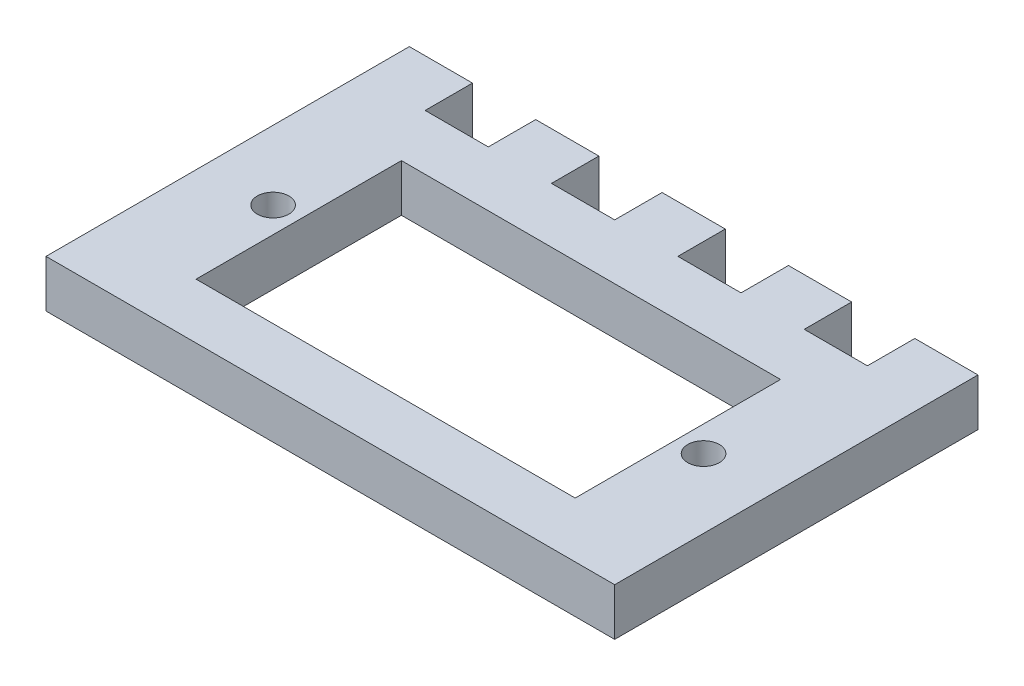
from build123d import *

# Parameters (mm, degrees)
SKETCH1_R           = 1
SKETCH1_W           = 24
SKETCH1_H           = 13
BOSS_EXTRUDE1_DEPTH = 3


with BuildPart() as part:
    # Sketch1 → Boss-Extrude1 (new body)
    with BuildSketch(Plane(origin=(0, 0, 0), x_dir=(1, 0, 0), z_dir=(0, 1, 0))):
        Polygon((-18, -10), (18, -10), (18, 10), (18, 13), (14, 13), (14, 10), (10, 10), (10, 13), (6, 13), (6, 10), (2, 10), (2, 13), (-2, 13), (-2, 10), (-6, 10), (-6, 13), (-10, 13), (-10, 10), (-14, 10), (-14, 13), (-18, 13), (-18, 10), align=None)
        with Locations(Location((-13.625, 0, 0), (0, 0, 270))):
            Circle(SKETCH1_R, mode=Mode.SUBTRACT)
        with Locations(Location((13.625, 0, 0), (0, 0, 90))):
            Circle(SKETCH1_R, mode=Mode.SUBTRACT)
        Rectangle(SKETCH1_W, SKETCH1_H, mode=Mode.SUBTRACT)
    extrude(amount=BOSS_EXTRUDE1_DEPTH)


solid = part.part
